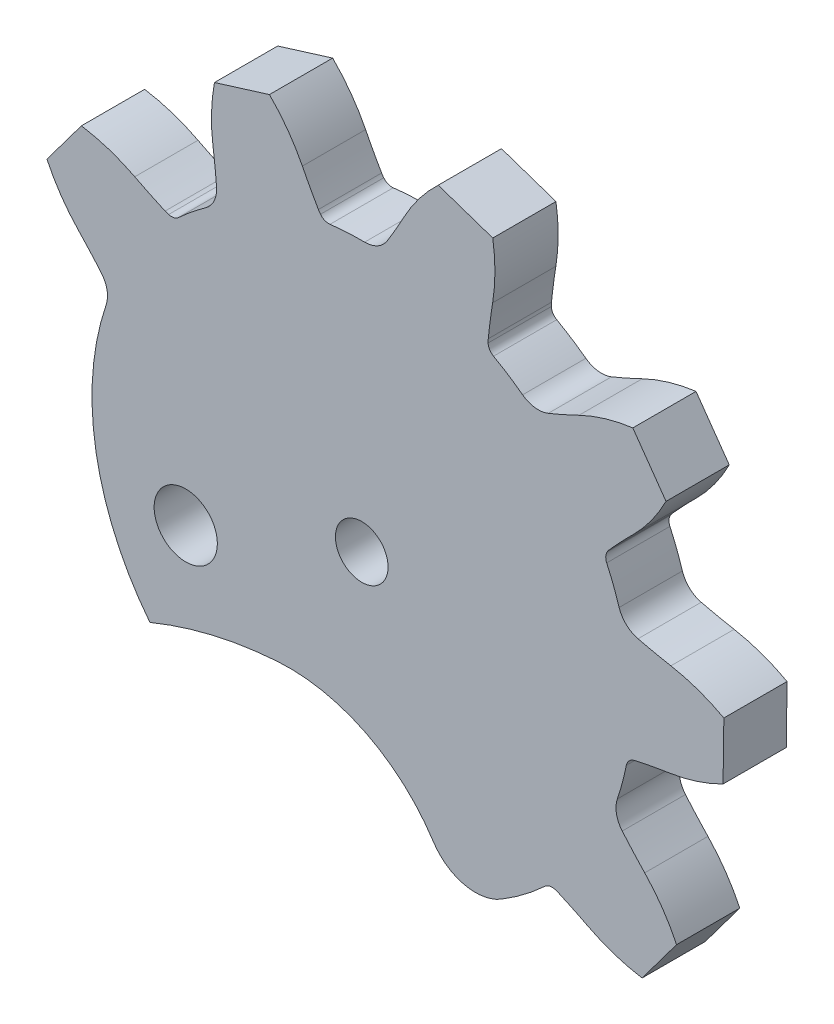
from build123d import *

# Parameters (mm, degrees)
SKETCH1_R           = 1.5
SKETCH1_R_2         = 1.25
BOSS_EXTRUDE1_DEPTH = 3


with BuildPart() as part:
    # Sketch1 → Boss-Extrude1 (new body)
    with BuildSketch(Plane.XY):
        with BuildLine():
            Line((18.079443034, -0.134472667), (18.116448206, 2.597069427))
            ThreePointArc((18.116448206, 2.597069427), (16.895577145, 3.141355734), (15.603766672, 3.48486619))
            ThreePointArc((15.603766672, 3.48486619), (14.82120671, 3.639343944), (14.043536913, 3.816807057))
            ThreePointArc((14.043536913, 3.816807057), (13.486015309, 4.11861181), (13.148996222, 4.655579763))
            ThreePointArc((13.148996222, 4.655579763), (12.877808188, 5.433093829), (12.557188118, 6.191561919))
            ThreePointArc((12.557188118, 6.191561919), (12.512759529, 6.440033201), (12.595364936, 6.678545725))
            ThreePointArc((12.595364936, 6.678545725), (12.647044724, 6.750316962), (12.70368256, 6.818243882))
            ThreePointArc((12.70368256, 6.818243882), (13.244598766, 7.404475621), (13.802549183, 7.974518889))
            ThreePointArc((13.802549183, 7.974518889), (14.673526858, 8.988509045), (15.372435088, 10.12794111))
            Line((15.372435088, 10.12794111), (13.796812742, 12.35955618))
            ThreePointArc((13.796812742, 12.35955618), (12.489183841, 12.082283047), (11.242176835, 11.600881699))
            ThreePointArc((11.242176835, 11.600881699), (10.518272782, 11.265879623), (9.784814499, 10.95234746))
            ThreePointArc((9.784814499, 10.95234746), (9.156373664, 10.868809657), (8.568097651, 11.105131008))
            ThreePointArc((8.568097651, 11.105131008), (7.891690622, 11.574752773), (7.186487179, 11.999910599))
            ThreePointArc((7.186487179, 11.999910599), (7.00449594, 12.174813619), (6.931130974, 12.416328545))
            ThreePointArc((6.931130974, 12.416328545), (6.930754726, 12.504769312), (6.936649256, 12.59301423))
            ThreePointArc((6.936649256, 12.59301423), (7.029681289, 13.385228238), (7.146009632, 14.174357956))
            ThreePointArc((7.146009632, 14.174357956), (7.254636913, 15.506641056), (7.150324186, 16.839268911))
            Line((7.150324186, 16.839268911), (4.563908504, 17.71855585))
            ThreePointArc((4.563908504, 17.71855585), (3.668991559, 16.72563219), (2.943102312, 15.603197991))
            ThreePointArc((2.943102312, 15.603197991), (2.55436091, 14.906675492), (2.145270277, 14.221906682))
            ThreePointArc((2.145270277, 14.221906682), (1.685953249, 13.784934925), (1.071121753, 13.630342949))
            ThreePointArc((1.071121753, 13.630342949), (0.247860223, 13.612692862), (-0.572562847, 13.542144585))
            ThreePointArc((-0.572562847, 13.542144585), (-0.822602268, 13.576672334), (-1.023914683, 13.728939169))
            ThreePointArc((-1.023914683, 13.728939169), (-1.076203253, 13.8002681), (-1.12330354, 13.875124455))
            ThreePointArc((-1.12330354, 13.875124455), (-1.513690755, 14.570721908), (-1.883417958, 15.277517345))
            ThreePointArc((-1.883417958, 15.277517345), (-2.578633, 16.419206529), (-3.446322769, 17.436011628))
            Line((-3.446322769, 17.436011628), (-6.055608905, 16.62711271))
            ThreePointArc((-6.055608905, 16.62711271), (-6.195986038, 15.297801614), (-6.123492507, 13.963066277))
            ThreePointArc((-6.123492507, 13.963066277), (-6.028585255, 13.171071275), (-5.957049521, 12.376624229))
            ThreePointArc((-5.957049521, 12.376624229), (-6.071799248, 11.753126877), (-6.478341494, 11.266670455))
            ThreePointArc((-6.478341494, 11.266670455), (-7.133999602, 10.768490249), (-7.756268571, 10.229182913))
            ThreePointArc((-7.756268571, 10.229182913), (-7.978849614, 10.110146965), (-8.231214979, 10.115004953))
            ThreePointArc((-8.231214979, 10.115004953), (-8.315443414, 10.14197682), (-8.397547808, 10.17485203))
            ThreePointArc((-8.397547808, 10.17485203), (-9.122239624, 10.508138343), (-9.836799148, 10.862627665))
            ThreePointArc((-9.836799148, 10.862627665), (-11.070307997, 11.377636469), (-12.369946808, 11.690233824))
            Line((-12.369946808, 11.690233824), (-14.005444781, 9.502120943))
            ThreePointArc((-14.005444781, 9.502120943), (-13.337662809, 8.344174067), (-12.494476564, 7.306961125))
            ThreePointArc((-12.494476564, 7.306961125), (-11.952172002, 6.722008792), (-11.427334121, 6.12133528))
            ThreePointArc((-11.427334121, 6.12133528), (-11.153686052, 5.549467129), (-11.196653727, 4.91695608))
            ThreePointArc((-11.196653727, 4.91695608), (-11.678838592, -1.351524146), (-9.118252224, -7.093452745))
            ThreePointArc((-9.118252224, -7.093452745), (-6.159667353, -6.136962556), (-3.085467527, -5.670707959))
            ThreePointArc((-3.085467527, -5.670707959), (1.133419318, -6.513694494), (4.3378838, -9.384415639))
            ThreePointArc((4.3378838, -9.384415639), (5.797671296, -10.408859622), (7.558678835, -10.127226075))
            ThreePointArc((7.558678835, -10.127226075), (8.631472289, -9.400453805), (9.623684759, -8.567028257))
            ThreePointArc((9.623684759, -8.567028257), (9.846265801, -8.447992309), (10.098631166, -8.452850297))
            ThreePointArc((10.098631166, -8.452850297), (10.182859602, -8.479822164), (10.264963995, -8.512697373))
            ThreePointArc((10.264963995, -8.512697373), (10.989655811, -8.845983686), (11.704215336, -9.200473008))
            ThreePointArc((11.704215336, -9.200473008), (12.937724185, -9.715481811), (14.237362996, -10.028079165))
            Line((14.237362996, -10.028079165), (15.872860968, -7.839966284))
            ThreePointArc((15.872860968, -7.839966284), (15.205078995, -6.682019407), (14.361892749, -5.644806466))
            ThreePointArc((14.361892749, -5.644806466), (13.819588187, -5.059854134), (13.294750306, -4.459180622))
            ThreePointArc((13.294750306, -4.459180622), (13.021102236, -3.887312471), (13.064069415, -3.254802895))
            ThreePointArc((13.064069415, -3.254802895), (13.301685284, -2.466379753), (13.488114756, -1.664309679))
            ThreePointArc((13.488114756, -1.664309679), (13.598219027, -1.43717772), (13.80524235, -1.292771275))
            ThreePointArc((13.80524235, -1.292771275), (13.889238251, -1.265083742), (13.974985665, -1.243420593))
            ThreePointArc((13.974985665, -1.243420593), (14.757174439, -1.087091722), (15.543628834, -0.953872058))
            ThreePointArc((15.543628834, -0.953872058), (16.844273034, -0.645484622), (18.079443034, -0.134472667))
        make_face()
        with Locations((-7.418095669, -2.256802895)):
            Circle(SKETCH1_R, mode=Mode.SUBTRACT)
        with Locations((0.933711072, 0.831073783)):
            Circle(SKETCH1_R_2, mode=Mode.SUBTRACT)
    extrude(amount=BOSS_EXTRUDE1_DEPTH)


solid = part.part
